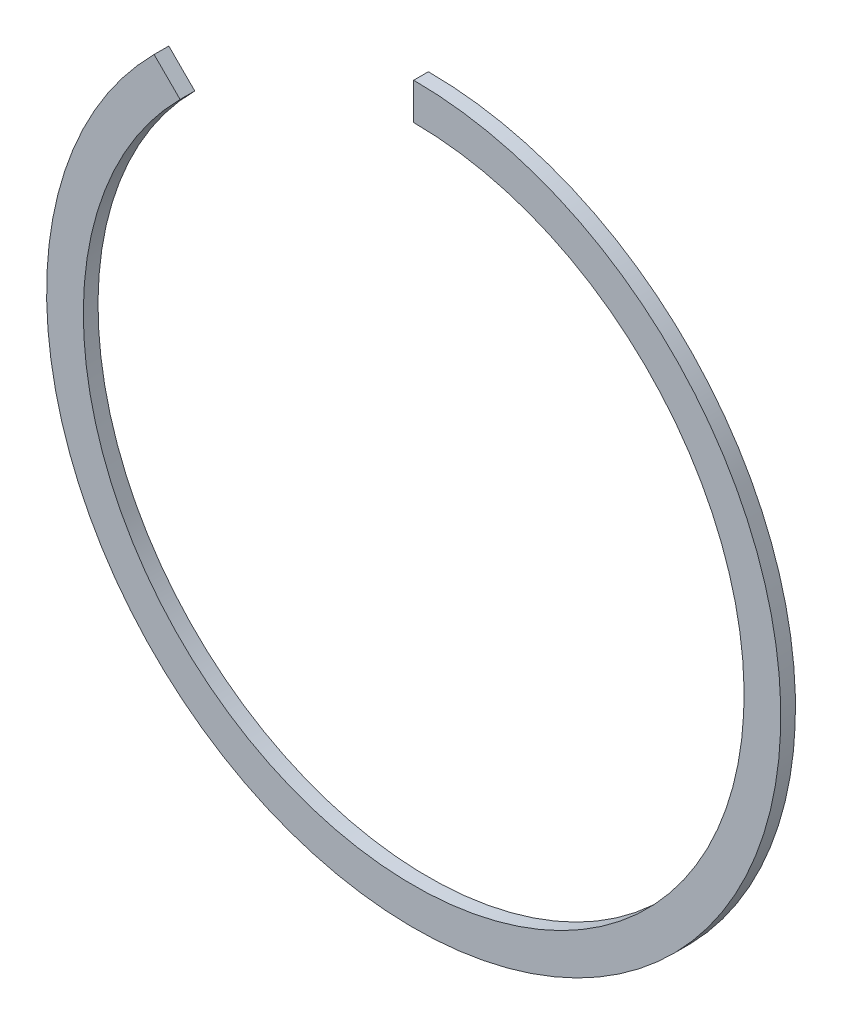
from build123d import *

# Parameters (mm, degrees)
BOSS_EXTRUDE1_DEPTH = 1


with BuildPart() as part:
    # Sketch1 → Boss-Extrude1 (new body)
    with BuildSketch(Plane.XY):
        with BuildLine():
            Line((0, 25), (0, 22.5))
            ThreePointArc((0, 22.5), (15.909902577, 15.909902577), (22.5, 0))
            ThreePointArc((22.5, 0), (-8.610377228, -20.787289482), (-15.909902577, 15.909902577))
            Line((-15.909902577, 15.909902577), (-17.67766953, 17.67766953))
            ThreePointArc((-17.67766953, 17.67766953), (-9.567085809, -23.096988313), (25, 0))
            ThreePointArc((25, 0), (17.67766953, 17.67766953), (0, 25))
        make_face()
    extrude(amount=BOSS_EXTRUDE1_DEPTH)


solid = part.part
